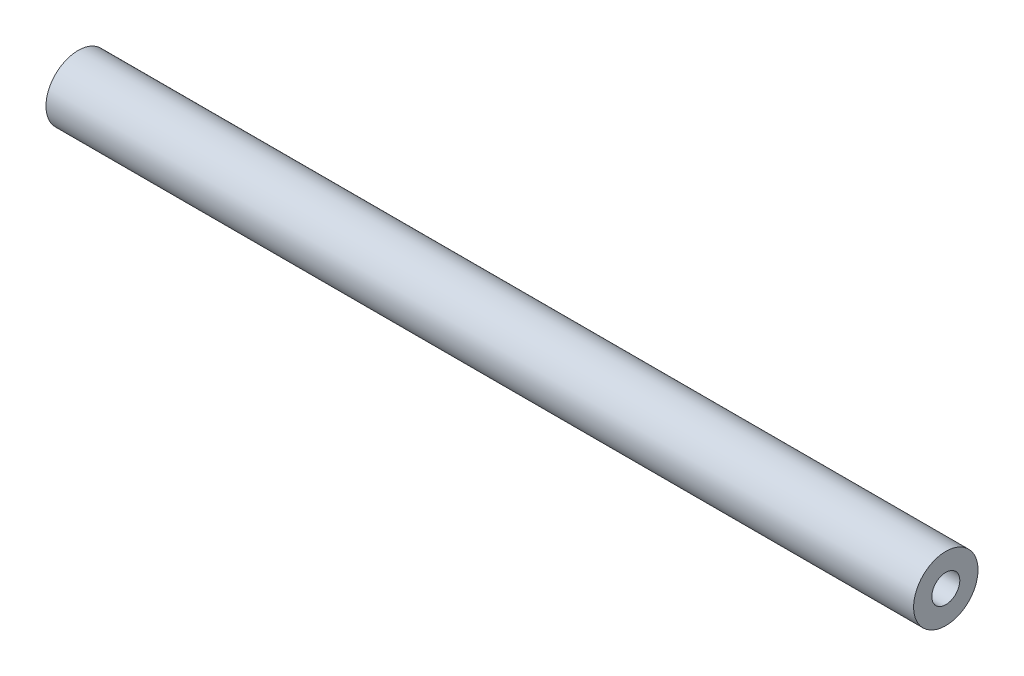
from build123d import *

# Parameters (mm, degrees)
SKETCH1_R           = 11.5
SKETCH1_R_2         = 5
BOSS_EXTRUDE1_DEPTH = 310


with BuildPart() as part:
    # Sketch1 → Boss-Extrude1 (new body)
    with BuildSketch(Plane(origin=(0, 0, 0), x_dir=(0, 0, -1), z_dir=(1, 0, 0))):
        Circle(SKETCH1_R)
        Circle(SKETCH1_R_2, mode=Mode.SUBTRACT)
    extrude(amount=BOSS_EXTRUDE1_DEPTH)


solid = part.part
